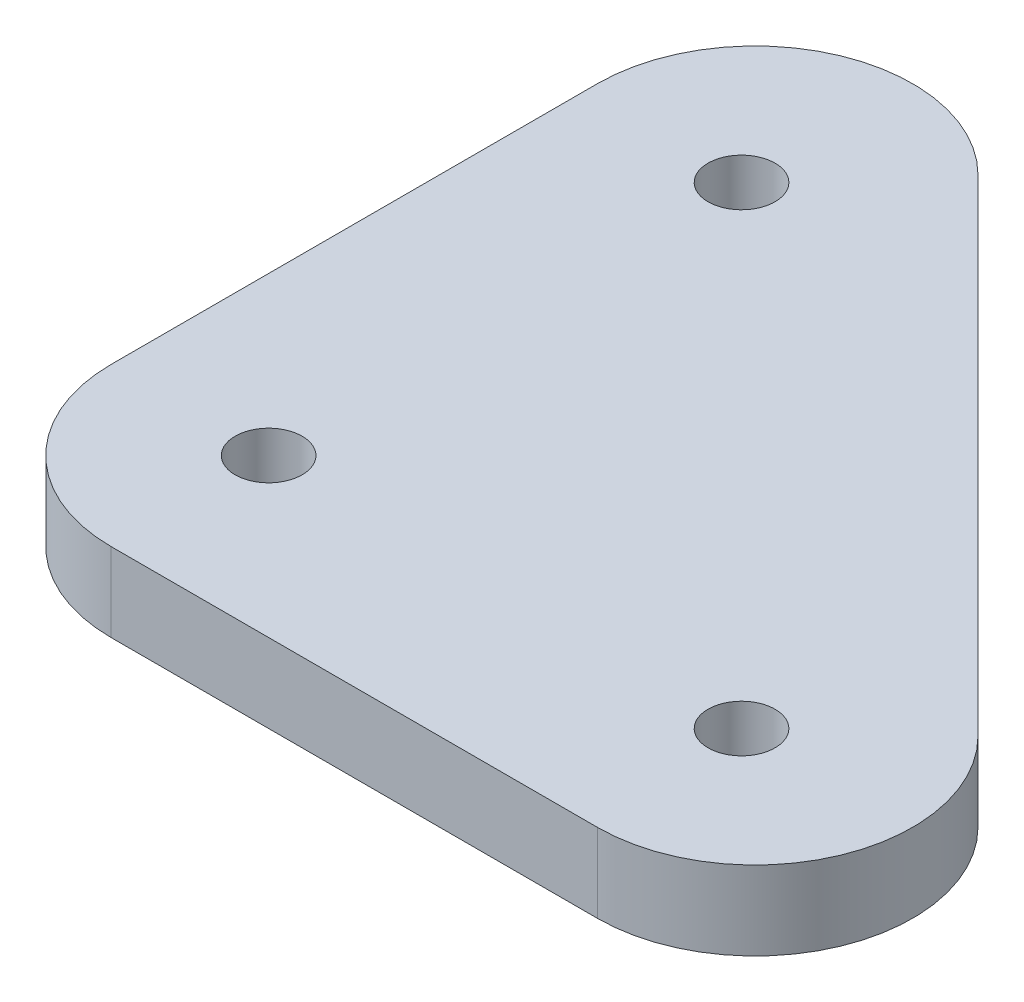
from build123d import *

# Parameters (mm, degrees)
SKETCH1_R           = 2.125
BOSS_EXTRUDE1_DEPTH = 5


with BuildPart() as part:
    # Sketch1 → Boss-Extrude1 (new body)
    with BuildSketch(Plane(origin=(0, 0, 0), x_dir=(1, 0, 0), z_dir=(0, 1, 0))):
        with BuildLine():
            Line((0, 10), (0, 40.857864376))
            ThreePointArc((0, 40.857864376), (6.173165676, 50.096659701), (17.071067812, 47.928932188))
            Line((17.071067812, 47.928932188), (47.928932188, 17.071067812))
            ThreePointArc((47.928932188, 17.071067812), (50.096659701, 6.173165676), (40.857864376, 0))
            Line((40.857864376, 0), (10, 0))
            ThreePointArc((10, 0), (2.928932188, 2.928932188), (0, 10))
        make_face()
        with Locations(Location((10, 10, 0), (0, 0, 270))):
            Circle(SKETCH1_R, mode=Mode.SUBTRACT)
        with Locations(Location((10, 40, 0), (0, 0, 270))):
            Circle(SKETCH1_R, mode=Mode.SUBTRACT)
        with Locations(Location((40, 10, 0), (0, 0, 270))):
            Circle(SKETCH1_R, mode=Mode.SUBTRACT)
    extrude(amount=BOSS_EXTRUDE1_DEPTH)


solid = part.part
